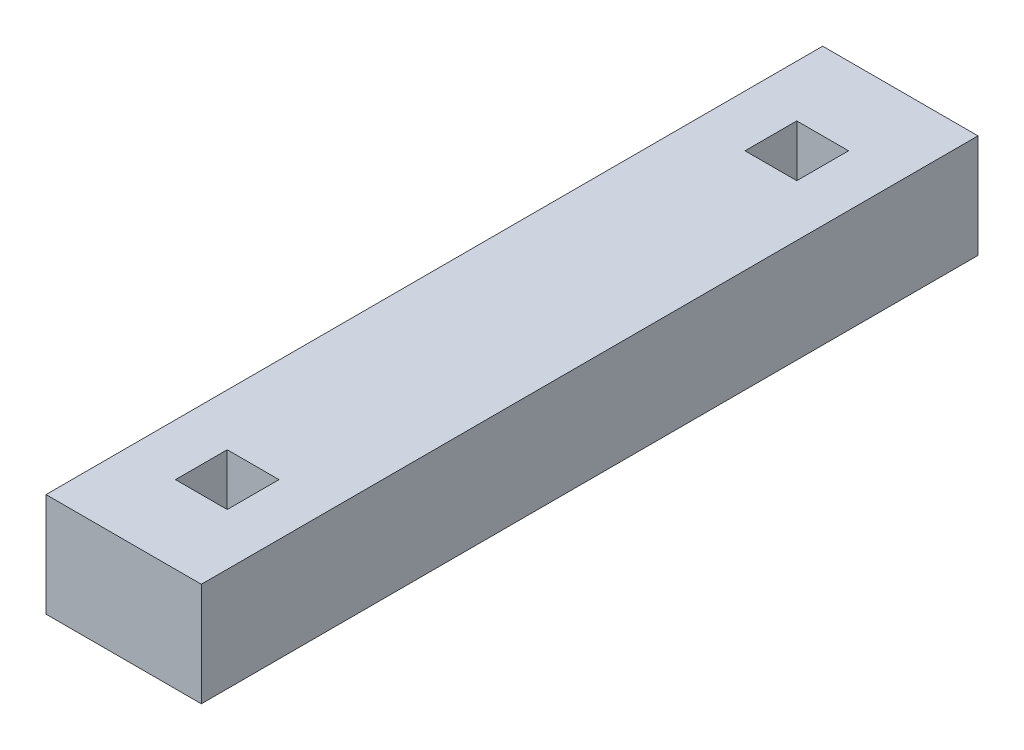
from build123d import *

# Parameters (mm, degrees)
SKETCH1_W           = 30
SKETCH1_H           = 150
SKETCH1_W_2         = 10
SKETCH1_H_2         = 10
BOSS_EXTRUDE1_DEPTH = 20


with BuildPart() as part:
    # Sketch1 → Boss-Extrude1 (new body)
    with BuildSketch(Plane(origin=(0, 0, 0), x_dir=(1, 0, 0), z_dir=(0, 1, 0))):
        with Locations((0, -5)):
            Rectangle(SKETCH1_W, SKETCH1_H)
        with Locations((0, 50)):
            Rectangle(SKETCH1_W_2, SKETCH1_H_2, mode=Mode.SUBTRACT)
        with Locations((0, -60)):
            Rectangle(SKETCH1_W_2, SKETCH1_H_2, mode=Mode.SUBTRACT)
    extrude(amount=BOSS_EXTRUDE1_DEPTH)


solid = part.part
